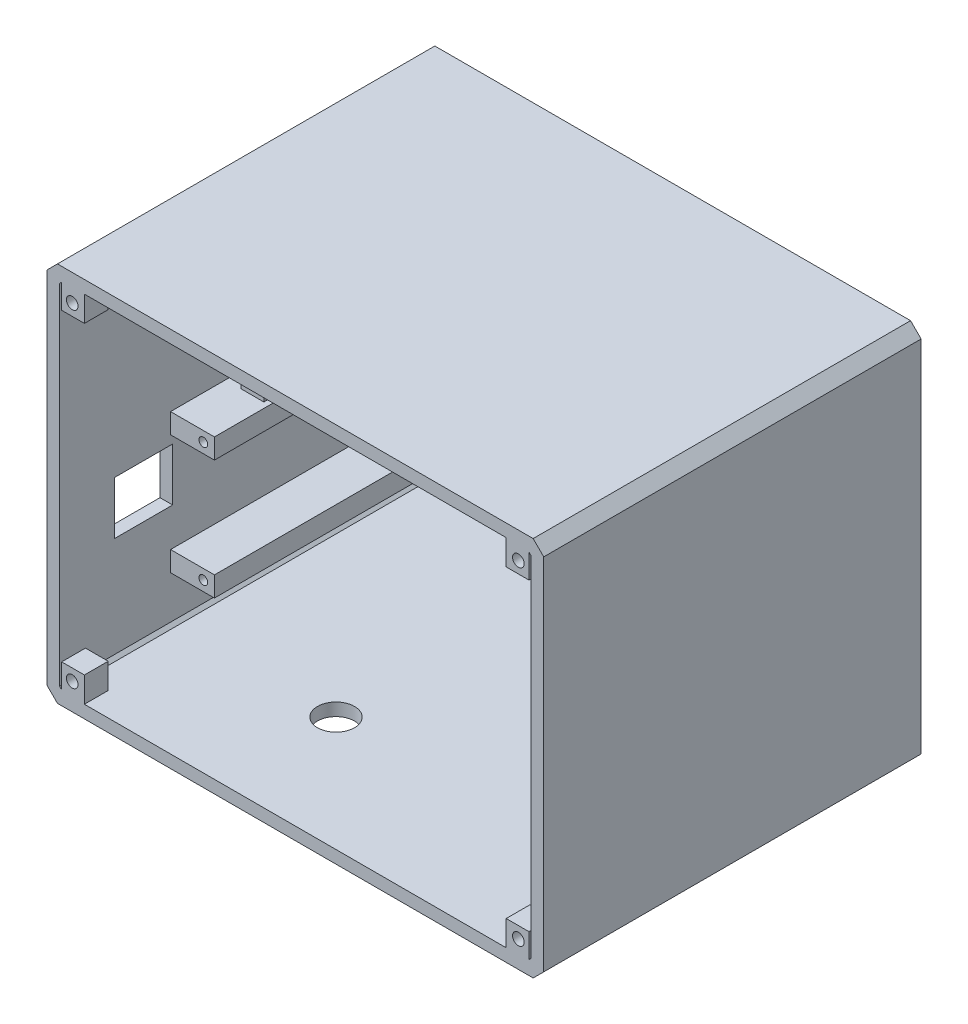
from build123d import *

# Parameters (mm, degrees)
PROFILE_R              = 1.3
PROFILE_R_2            = 1.1
PROFILE_R_3            = 2.1
EXTRUDE_289_DEPTH      = 2.8
F_2_4_START            = 2.8
F_2_4_MM_DEPTH         = 68.6
EXTRUDE_START          = 66.9
F_2_2_PROFILE_W        = 4.3
F_2_2_PROFILE_H        = 5.3
F_2_2_PROFILE_R        = 1.1
EXTRUDE_2_2_DEPTH      = 4.5
EXTRUDE_START_2        = 2.8
PROFILE_2_W            = 5
PROFILE_2_H            = 31.5
EXTRUDE_595_DEPTH      = 1.2
PROFILE_3_W            = 1.6
PROFILE_3_H            = 3.4
EXTRUDE_686_DEPTH      = 3
F_2_2_PROFILE_2_R      = 2.7
F_2_2_PROFILE_2_R_2    = 1.1
EXTRUDE_2_2_2_DEPTH    = 11.2
GNSS_START             = 2.8
GNSS_2_6_3MM_PROFILE_R = 1.3
GNSS_2_6_3MM_DEPTH     = 6
PROFILE_4_W            = 8.6
PROFILE_4_H            = 3.8
EXTRUDE_962_DEPTH      = 41.6
EXTRUDE_START_3        = 44.4
F_1_65_PROFILE_W       = 8.6
F_1_65_PROFILE_H       = 3.8
F_1_65_PROFILE_R       = 0.825
EXTRUDE_1_65_DEPTH     = 6
PROFILE_5_W            = 4.3
PROFILE_5_H            = 3.15
PROFILE_5_H_2          = 3.4
EXTRUDE_1232_DEPTH     = 31.2
EXTRUDE_START_4        = 34
F_1_65_PROFILE_2_W     = 4.3
F_1_65_PROFILE_2_H     = 3.15
F_1_65_PROFILE_2_R     = 0.825
F_1_65_PROFILE_2_H_2   = 3.4
EXTRUDE_1_65_2_DEPTH   = 6
TYPE_C_START           = 61
TYPE_C_10_11_PROFILE_W = 3.1
TYPE_C_10_11_PROFILE_H = 10
TYPE_C_10_11_DEPTH     = 11
F_7_PROFILE_R          = 3.5
CUT_EXTRUDE_7_DEPTH    = 2.5


with BuildPart() as part:
    # profile → Extrude 289 (new body)
    with BuildSketch(Plane.XY):
        Polygon((-45, -36), (45, -36), (47, -34), (47, 34), (45, 36), (-45, 36), (-47, 34), (-47, -34), align=None)
        with Locations((21.1, 3.4)):
            Circle(PROFILE_R, mode=Mode.SUBTRACT)
        with Locations((41.6, 3.4)):
            Circle(PROFILE_R, mode=Mode.SUBTRACT)
        with Locations((-32, 27.5)):
            Circle(PROFILE_R_2, mode=Mode.SUBTRACT)
        with Locations((-13, 27.5)):
            Circle(PROFILE_R_2, mode=Mode.SUBTRACT)
        with Locations((-41, -10)):
            Circle(PROFILE_R_3, mode=Mode.SUBTRACT)
        with Locations((41, -10)):
            Circle(PROFILE_R_3, mode=Mode.SUBTRACT)
        with Locations((-42, 15)):
            Circle(PROFILE_R_3, mode=Mode.SUBTRACT)
        with Locations((42, 15)):
            Circle(PROFILE_R_3, mode=Mode.SUBTRACT)
        with BuildLine():
            Line((-1.8, -33.5), (3.8, -33.5))
            ThreePointArc((3.8, -33.5), (4.5, -32.8), (3.8, -32.1))
            Line((3.8, -32.1), (-1.8, -32.1))
            ThreePointArc((-1.8, -32.1), (-2.5, -32.8), (-1.8, -33.5))
        make_face(mode=Mode.SUBTRACT)
        with BuildLine():
            Line((-1.6, 1.2), (3.6, 1.2))
            ThreePointArc((3.6, 1.2), (4.5, 2.1), (3.6, 3))
            Line((3.6, 3), (-1.6, 3))
            ThreePointArc((-1.6, 3), (-2.5, 2.1), (-1.6, 1.2))
        make_face(mode=Mode.SUBTRACT)
    extrude(amount=EXTRUDE_289_DEPTH)

    # 2.4 mm周壁 profile → 2.4 mm周壁 (add)
    with BuildSketch(Plane.XY.offset(F_2_4_START)):
        Polygon((-45, -36), (45, -36), (47, -34), (47, 34), (45, 36), (-45, 36), (-47, 34), (-47, -34), align=None)
        Polygon((-44, -33.6), (44, -33.6), (44.6, -33), (44.6, 33), (44, 33.6), (-44, 33.6), (-44.6, 33), (-44.6, -33), align=None, mode=Mode.SUBTRACT)
    extrude(amount=F_2_4_MM_DEPTH)

    # 2.2_ profile → Extrude 2.2 (add)
    # profile 1 of 4: a face of its own
    with BuildSketch(Plane.XY.offset(EXTRUDE_START)):
        with Locations((-42.05, -31.45)):
            Rectangle(F_2_2_PROFILE_W, F_2_2_PROFILE_H)
        with Locations((-42.2, -31)):
            Circle(F_2_2_PROFILE_R, mode=Mode.SUBTRACT)
    # profile 2 of 4: a face of its own
    with BuildSketch(Plane.XY.offset(EXTRUDE_START)):
        with Locations((-42.05, 31.45)):
            Rectangle(F_2_2_PROFILE_W, F_2_2_PROFILE_H)
        with Locations((-42.2, 31)):
            Circle(F_2_2_PROFILE_R, mode=Mode.SUBTRACT)
    # profile 3 of 4: a face of its own
    with BuildSketch(Plane.XY.offset(EXTRUDE_START)):
        with Locations((42.05, -31.45)):
            Rectangle(F_2_2_PROFILE_W, F_2_2_PROFILE_H)
        with Locations((42.2, -31)):
            Circle(F_2_2_PROFILE_R, mode=Mode.SUBTRACT)
    # profile 4 of 4: a face of its own
    with BuildSketch(Plane.XY.offset(EXTRUDE_START)):
        with Locations((42.05, 31.45)):
            Rectangle(F_2_2_PROFILE_W, F_2_2_PROFILE_H)
        with Locations((42.2, 31)):
            Circle(F_2_2_PROFILE_R, mode=Mode.SUBTRACT)
    extrude(amount=EXTRUDE_2_2_DEPTH)

    # profile 2 → Extrude 595 (add)
    with BuildSketch(Plane.XY.offset(EXTRUDE_START_2)):
        with Locations((-25.5, -16.05)):
            Rectangle(PROFILE_2_W, PROFILE_2_H)
        with Locations((25.5, -16.05)):
            Rectangle(PROFILE_2_W, PROFILE_2_H)
    extrude(amount=EXTRUDE_595_DEPTH)

    # profile 3 → Extrude 686 (add)
    with BuildSketch(Plane.XY.offset(EXTRUDE_START_2)):
        with Locations((-35.7, -29.7)):
            Rectangle(PROFILE_3_W, PROFILE_3_H)
        with Locations((35.7, -29.7)):
            Rectangle(PROFILE_3_W, PROFILE_3_H)
    extrude(amount=EXTRUDE_686_DEPTH)

    # 2.2 _ profile 2 → Extrude 2.2 2 (add)
    # profile 1 of 2: a face of its own
    with BuildSketch(Plane.XY.offset(EXTRUDE_START_2)):
        with Locations((-32, 27.5)):
            Circle(F_2_2_PROFILE_2_R)
        with Locations((-32, 27.5)):
            Circle(F_2_2_PROFILE_2_R_2, mode=Mode.SUBTRACT)
    # profile 2 of 2: a face of its own
    with BuildSketch(Plane.XY.offset(EXTRUDE_START_2)):
        with Locations((-13, 27.5)):
            Circle(F_2_2_PROFILE_2_R)
        with Locations((-13, 27.5)):
            Circle(F_2_2_PROFILE_2_R_2, mode=Mode.SUBTRACT)
    extrude(amount=EXTRUDE_2_2_2_DEPTH)

    # GNSS单边凸台 Ø2.6 贯穿，板内接触3mm profile → GNSS单边凸台 Ø2.6 贯穿，板内接触3mm (add)
    with BuildSketch(Plane.XY.offset(GNSS_START)):
        Polygon((18.45, 1.2), (44.2, 1.2), (44.2, 5), (38.9, 5), (38.9, 2), (23.8, 2), (23.8, 5), (18.45, 5), align=None)
        with Locations((21.1, 3.4)):
            Circle(GNSS_2_6_3MM_PROFILE_R, mode=Mode.SUBTRACT)
        with Locations((41.6, 3.4)):
            Circle(GNSS_2_6_3MM_PROFILE_R, mode=Mode.SUBTRACT)
    extrude(amount=GNSS_2_6_3MM_DEPTH)

    # profile 4 → Extrude 962 (add)
    with BuildSketch(Plane.XY.offset(EXTRUDE_START_2)):
        with Locations((40.6, -23)):
            Rectangle(PROFILE_4_W, PROFILE_4_H)
        with Locations((-40.6, -23)):
            Rectangle(PROFILE_4_W, PROFILE_4_H)
        with Locations((40.6, -0.4)):
            Rectangle(PROFILE_4_W, PROFILE_4_H)
        with Locations((-40.6, -0.4)):
            Rectangle(PROFILE_4_W, PROFILE_4_H)
    extrude(amount=EXTRUDE_962_DEPTH)

    # 1.65_ profile → Extrude 1.65 (add)
    # profile 1 of 4: a face of its own
    with BuildSketch(Plane.XY.offset(EXTRUDE_START_3)):
        with Locations((40.6, -23)):
            Rectangle(F_1_65_PROFILE_W, F_1_65_PROFILE_H)
        with Locations((38.4, -23)):
            Circle(F_1_65_PROFILE_R, mode=Mode.SUBTRACT)
    # profile 2 of 4: a face of its own
    with BuildSketch(Plane.XY.offset(EXTRUDE_START_3)):
        with Locations((-40.6, -23)):
            Rectangle(F_1_65_PROFILE_W, F_1_65_PROFILE_H)
        with Locations((-38.4, -23)):
            Circle(F_1_65_PROFILE_R, mode=Mode.SUBTRACT)
    # profile 3 of 4: a face of its own
    with BuildSketch(Plane.XY.offset(EXTRUDE_START_3)):
        with Locations((40.6, -0.4)):
            Rectangle(F_1_65_PROFILE_W, F_1_65_PROFILE_H)
        with Locations((38.4, -0.4)):
            Circle(F_1_65_PROFILE_R, mode=Mode.SUBTRACT)
    # profile 4 of 4: a face of its own
    with BuildSketch(Plane.XY.offset(EXTRUDE_START_3)):
        with Locations((-40.6, -0.4)):
            Rectangle(F_1_65_PROFILE_W, F_1_65_PROFILE_H)
        with Locations((-38.4, -0.4)):
            Circle(F_1_65_PROFILE_R, mode=Mode.SUBTRACT)
    extrude(amount=EXTRUDE_1_65_DEPTH)

    # profile 5 → Extrude 1232 (add)
    with BuildSketch(Plane.XY.offset(EXTRUDE_START_2)):
        with Locations((-39.5, 3.025)):
            Rectangle(PROFILE_5_W, PROFILE_5_H)
        with Locations((-39.5, 32.3)):
            Rectangle(PROFILE_5_W, PROFILE_5_H_2)
        with Locations((15, 3.025)):
            Rectangle(PROFILE_5_W, PROFILE_5_H)
        with Locations((15, 32.3)):
            Rectangle(PROFILE_5_W, PROFILE_5_H_2)
    extrude(amount=EXTRUDE_1232_DEPTH)

    # 1.65_ profile 2 → Extrude 1.65 2 (add)
    # profile 1 of 4: a face of its own
    with BuildSketch(Plane.XY.offset(EXTRUDE_START_4)):
        with Locations((-39.5, 3.025)):
            Rectangle(F_1_65_PROFILE_2_W, F_1_65_PROFILE_2_H)
        with Locations((-39.5, 3.2)):
            Circle(F_1_65_PROFILE_2_R, mode=Mode.SUBTRACT)
    # profile 2 of 4: a face of its own
    with BuildSketch(Plane.XY.offset(EXTRUDE_START_4)):
        with Locations((-39.5, 32.3)):
            Rectangle(F_1_65_PROFILE_2_W, F_1_65_PROFILE_2_H_2)
        with Locations((-39.5, 32.2)):
            Circle(F_1_65_PROFILE_2_R, mode=Mode.SUBTRACT)
    # profile 3 of 4: a face of its own
    with BuildSketch(Plane.XY.offset(EXTRUDE_START_4)):
        with Locations((15, 3.025)):
            Rectangle(F_1_65_PROFILE_2_W, F_1_65_PROFILE_2_H)
        with Locations((15, 3.2)):
            Circle(F_1_65_PROFILE_2_R, mode=Mode.SUBTRACT)
    # profile 4 of 4: a face of its own
    with BuildSketch(Plane.XY.offset(EXTRUDE_START_4)):
        with Locations((15, 32.3)):
            Rectangle(F_1_65_PROFILE_2_W, F_1_65_PROFILE_2_H_2)
        with Locations((15, 32.2)):
            Circle(F_1_65_PROFILE_2_R, mode=Mode.SUBTRACT)
    extrude(amount=EXTRUDE_1_65_2_DEPTH)

    # Type-C 暂定10×11开口 profile → Type-C 暂定10×11开口 (cut)
    with BuildSketch(Plane.XY.offset(TYPE_C_START)):
        with Locations((-45.75, -9)):
            Rectangle(TYPE_C_10_11_PROFILE_W, TYPE_C_10_11_PROFILE_H)
    extrude(amount=-TYPE_C_10_11_DEPTH, mode=Mode.SUBTRACT)

    # 反面天线连接位置 Ø7预留孔 profile → 反面天线连接位置 Ø7预留孔 (cut)
    with BuildSketch(Plane.XZ.offset(36)):
        with Locations(Location((-14, 49.7, 0), (0, 0, 270))):
            Circle(F_7_PROFILE_R)
    extrude(amount=-CUT_EXTRUDE_7_DEPTH, mode=Mode.SUBTRACT)


solid = part.part
